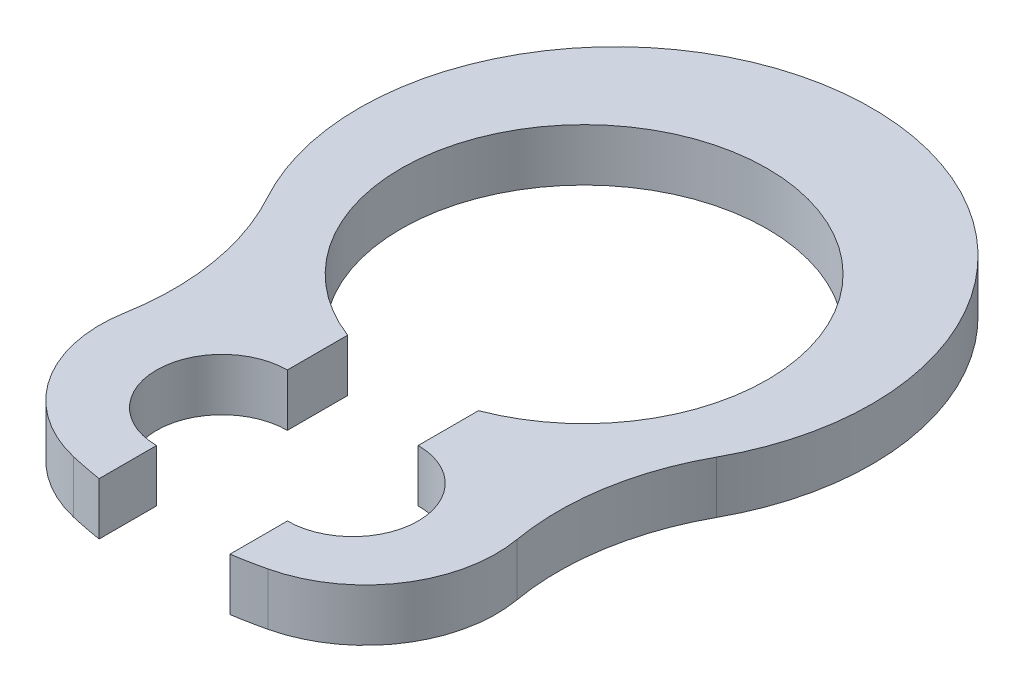
from build123d import *

# Parameters (mm, degrees)
EXTRUDE_1_DEPTH     = 0.4
SKETCH_2_R          = 0.5
CUT_EXTRUDE_1_DEPTH = 4.780310145


with BuildPart() as part:
    # 草图1 → 凸台-拉伸1 (new body)
    with BuildSketch(Plane(origin=(0, 0, 0), x_dir=(1, 0, 0), z_dir=(0, 1, 0))):
        with BuildLine():
            Line((-0.5, -3.207669683), (-0.5, -1.307669683))
            ThreePointArc((-0.5, -1.307669683), (0, 1.4), (0.5, -1.307669683))
            Line((0.5, -1.307669683), (0.5, -3.207669683))
            ThreePointArc((0.5, -3.207669683), (0.622614647, -3.186141208), (0.744313737, -3.159927508))
            ThreePointArc((0.744313737, -3.159927508), (1.349908047, -2.737016303), (1.5, -2.013779993))
            ThreePointArc((1.5, -2.013779993), (1.496939857, -1.340560945), (1.717434649, -0.704467165))
            ThreePointArc((1.717434649, -0.704467165), (0, 2.2), (-1.717434649, -0.704467165))
            ThreePointArc((-1.717434649, -0.704467165), (-1.496939857, -1.340560945), (-1.5, -2.013779993))
            ThreePointArc((-1.5, -2.013779993), (-1.349908047, -2.737016303), (-0.744313737, -3.159927508))
            ThreePointArc((-0.744313737, -3.159927508), (-0.622614647, -3.186141208), (-0.5, -3.207669683))
        make_face()
    extrude(amount=EXTRUDE_1_DEPTH)

    # 草图2 → 切除-拉伸1 (cut, through all)
    with BuildSketch(Plane(origin=(0, 0.4, 0), x_dir=(1, 0, 0), z_dir=(0, 1, 0))):
        with Locations((-0.5, -2.268759492)):
            Circle(SKETCH_2_R)
        with Locations((0.5, -2.268759492)):
            Circle(SKETCH_2_R)
    extrude(amount=-CUT_EXTRUDE_1_DEPTH, mode=Mode.SUBTRACT)


solid = part.part
